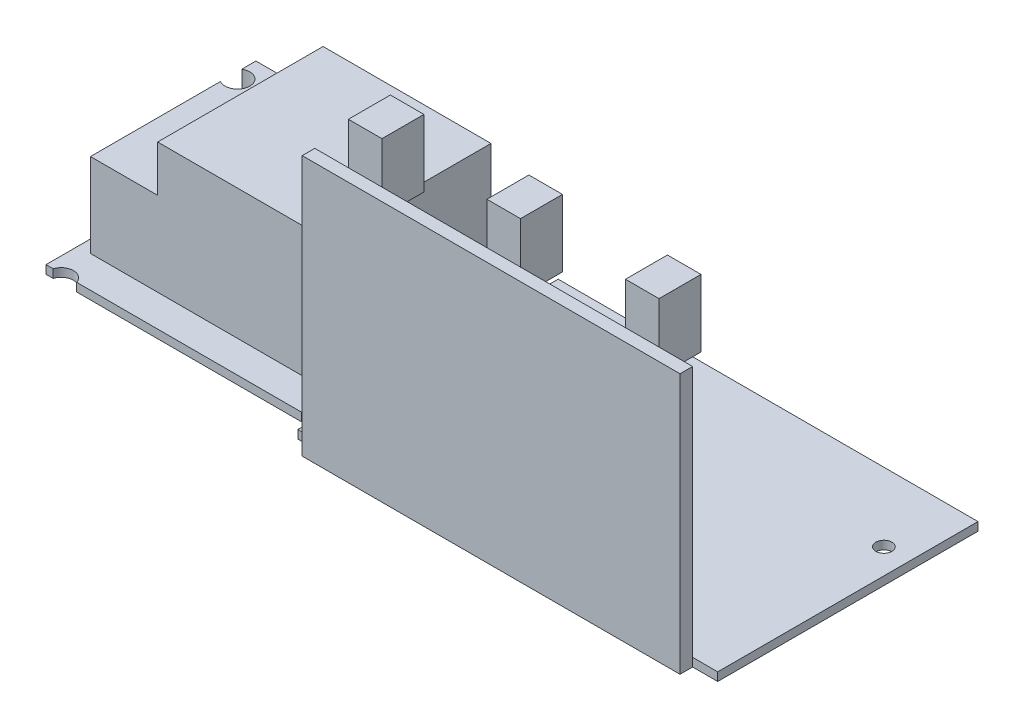
from build123d import *

# Parameters (mm, degrees)
ESQUISSE2_R                  = 0.956521087
BOSS_EXTRU_4_DEPTH           = 1
BOSS_EXTRU_5_DEPTH           = 1
BOSS_EXTRU_6_DEPTH           = 10
ESQUISSE2_6_W                = 20
ESQUISSE2_6_H                = 19.702752037
BOSS_EXTRU_7_DEPTH           = 15.5
ESQUISSE2_7_W                = 45
ESQUISSE2_7_H                = 1.5
BOSS_EXTRU_8_DEPTH           = 31
CORPS_D_PLACER_COPIER1_ANGLE = 180
ESQUISSE3_W                  = 4
ESQUISSE3_H                  = 8
ESQUISSE3_W_2                = 3.999542242
BOSS_EXTRU_9_DEPTH           = 5


with BuildPart() as part:
    # Esquisse2 → Boss.-Extru.4 (new body)
    with BuildSketch(Plane(origin=(0, 0, 0), x_dir=(1, 0, 0), z_dir=(0, 1, 0))):
        with BuildLine():
            Line((-46.635654673, 0.782015805), (-46.635654673, -30.217984195))
            Line((-46.635654673, -30.217984195), (-43.648603169, -30.217984195))
            Line((-43.648603169, -30.217984195), (1.351396831, -30.217984195))
            Line((1.351396831, -30.217984195), (3.364345327, -30.217984195))
            Line((3.364345327, -30.217984195), (3.364345327, -28.569170691))
            ThreePointArc((3.364345327, -28.569170691), (3.059148953, -27.670736232), (3.364345327, -26.772301773))
            Line((3.364345327, -26.772301773), (3.364345327, -7.569170691))
            ThreePointArc((3.364345327, -7.569170691), (3.059148953, -6.670736232), (3.364345327, -5.772301773))
            Line((3.364345327, -5.772301773), (3.364345327, 0.782015805))
            Line((3.364345327, 0.782015805), (-46.635654673, 0.782015805))
        make_face()
        with Locations((-43.635654673, -7.420736232)):
            Circle(ESQUISSE2_R, mode=Mode.SUBTRACT)
    extrude(amount=-BOSS_EXTRU_4_DEPTH)

    # Esquisse2<7> → Boss.-Extru.8 (add)
    with BuildSketch(Plane(origin=(0, 0, 0), x_dir=(1, 0, 0), z_dir=(0, 1, 0))):
        with Locations((-21.148603169, -30.967984195)):
            Rectangle(ESQUISSE2_7_W, ESQUISSE2_7_H)
    extrude(amount=-BOSS_EXTRU_8_DEPTH)


with BuildPart() as body_2:
    # Esquisse2<4> → Boss.-Extru.5 (new body)
    with BuildSketch(Plane(origin=(0, 0, 0), x_dir=(1, 0, 0), z_dir=(0, 1, 0))):
        with BuildLine():
            Line((36.364345327, 0.782015805), (3.364345327, 0.782015805))
            Line((3.364345327, 0.782015805), (3.364345327, -5.772301773))
            ThreePointArc((3.364345327, -5.772301773), (5.008577373, -5.274117933), (6.009148953, -6.670736232))
            ThreePointArc((6.009148953, -6.670736232), (5.008577373, -8.067354532), (3.364345327, -7.569170691))
            Line((3.364345327, -7.569170691), (3.364345327, -26.772301773))
            ThreePointArc((3.364345327, -26.772301773), (4.785835671, -26.217368145), (5.937944021, -27.217984195))
            Line((5.937944021, -27.217984195), (32.710550259, -27.217984195))
            ThreePointArc((32.710550259, -27.217984195), (34.114345327, -26.195736232), (35.518140395, -27.217984195))
            Line((35.518140395, -27.217984195), (36.364345327, -27.217984195))
            Line((36.364345327, -27.217984195), (36.364345327, 0.782015805))
        make_face()
        with BuildLine():
            Line((34.864345327, -23.420736232), (26.864345327, -23.420736232))
            Line((26.864345327, -23.420736232), (6.864345327, -23.420736232))
            Line((6.864345327, -23.420736232), (6.864345327, -3.717984195))
            Line((6.864345327, -3.717984195), (26.864345327, -3.717984195))
            Line((26.864345327, -3.717984195), (34.864345327, -3.717984195))
            Line((34.864345327, -3.717984195), (34.864345327, -5.400647653))
            ThreePointArc((34.864345327, -5.400647653), (35.395336155, -5.939512942), (35.589345327, -6.670736232))
            ThreePointArc((35.589345327, -6.670736232), (35.395336155, -7.401959522), (34.864345327, -7.940824812))
            Line((34.864345327, -7.940824812), (34.864345327, -23.420736232))
        make_face(mode=Mode.SUBTRACT)
    extrude(amount=BOSS_EXTRU_5_DEPTH)


with BuildPart() as body_3:
    # Esquisse2<5> → Boss.-Extru.6 (new body)
    with BuildSketch(Plane(origin=(0, 0, 0), x_dir=(1, 0, 0), z_dir=(0, 1, 0))):
        with BuildLine():
            Line((26.864345327, -3.717984195), (26.864345327, -23.420736232))
            Line((26.864345327, -23.420736232), (34.864345327, -23.420736232))
            Line((34.864345327, -23.420736232), (34.864345327, -7.940824812))
            ThreePointArc((34.864345327, -7.940824812), (32.639345327, -6.670736232), (34.864345327, -5.400647653))
            Line((34.864345327, -5.400647653), (34.864345327, -3.717984195))
            Line((34.864345327, -3.717984195), (26.864345327, -3.717984195))
        make_face()
    extrude(amount=-BOSS_EXTRU_6_DEPTH)

    # Esquisse2<6> → Boss.-Extru.7 (add)
    with BuildSketch(Plane(origin=(0, 0, 0), x_dir=(1, 0, 0), z_dir=(0, 1, 0))):
        with Locations((16.864345327, -13.569360214)):
            Rectangle(ESQUISSE2_6_W, ESQUISSE2_6_H)
    extrude(amount=-BOSS_EXTRU_7_DEPTH)


with BuildPart() as body_2_1:
    # Corps-Déplacer/Copier1: moved
    add(body_2.part.rotate(Axis((-5.135654673, -15, 0), (0, 0, 1)), CORPS_D_PLACER_COPIER1_ANGLE))


with BuildPart() as part_1:
    # Corps-Déplacer/Copier1: moved
    add(part.part.rotate(Axis((-5.135654673, -15, 0), (0, 0, 1)), CORPS_D_PLACER_COPIER1_ANGLE))

    # Esquisse3 → Boss.-Extru.9 (add)
    with BuildSketch(Plane(origin=(0, 0, 30.217984195), x_dir=(-1, 0, 0), z_dir=(0, 0, -1))):
        with Locations((-27.377293824, 2)):
            Rectangle(ESQUISSE3_W, ESQUISSE3_H)
        with Locations((-10.877293824, 2)):
            Rectangle(ESQUISSE3_W, ESQUISSE3_H)
        with Locations((5.622935055, 2)):
            Rectangle(ESQUISSE3_W_2, ESQUISSE3_H)
    extrude(amount=BOSS_EXTRU_9_DEPTH)


with BuildPart() as body_3_1:
    # Corps-Déplacer/Copier1: moved
    add(body_3.part.rotate(Axis((-5.135654673, -15, 0), (0, 0, 1)), CORPS_D_PLACER_COPIER1_ANGLE))


solid = Compound([body_2_1.part, part_1.part, body_3_1.part])
